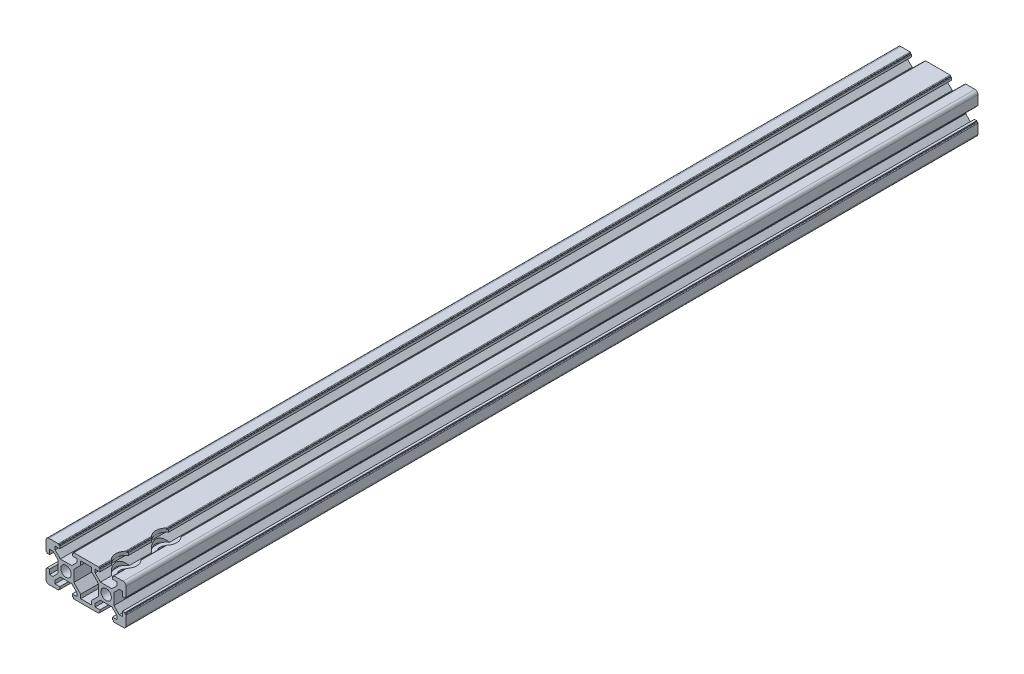
from build123d import *

# Parameters (mm, degrees)
SKETCH_1_R               = 2.6
EXTRUDE_1_DEPTH          = 212.5
FILLET_1_R               = 1.5
FILLET_2_R               = 0.3
CUT_EXTRUDE_1_DEPTH      = 214.891234042
CUT_EXTRUDE_1_DEPTH_BACK = 214.891234042
SKETCH_2_R               = 3.1
SKETCH_3_R               = 5.25
CUT_EXTRUDE_2_DEPTH      = 214.891234141


with BuildPart() as part:
    # 草图1 → 凸台-拉伸1 (new, symmetric)
    with BuildSketch(Plane.XY):
        Polygon((-13.9, 0), (-13.9, 2.839339828), (-16.560660172, 5.5), (-18.2, 5.5), (-18.2, 3.1), (-19.4, 3.1), (-19.4, 3.6), (-20, 3.6), (-20, 10), (-13.6, 10), (-13.6, 9.4), (-13.1, 9.4), (-13.1, 8.2), (-15.5, 8.2), (-15.5, 6.560660172), (-12.839339828, 3.9), (-7.160660172, 3.9), (-4.5, 6.560660172), (-4.5, 8.2), (-6.9, 8.2), (-6.9, 9.4), (-6.4, 9.4), (-6.4, 10), (6.4, 10), (6.4, 9.4), (6.9, 9.4), (6.9, 8.2), (4.5, 8.2), (4.5, 6.560660172), (7.160660172, 3.9), (12.839339828, 3.9), (15.5, 6.560660172), (15.5, 8.2), (13.1, 8.2), (13.1, 9.4), (13.6, 9.4), (13.6, 10), (20, 10), (20, 3.6), (19.4, 3.6), (19.4, 3.1), (18.2, 3.1), (18.2, 5.5), (16.560660172, 5.5), (13.9, 2.839339828), (13.9, 0), (13.9, -2.839339828), (16.560660172, -5.5), (18.2, -5.5), (18.2, -3.1), (19.4, -3.1), (19.4, -3.6), (20, -3.6), (20, -10), (13.6, -10), (13.6, -9.4), (13.1, -9.4), (13.1, -8.2), (15.5, -8.2), (15.5, -6.560660172), (12.839339828, -3.9), (7.160660172, -3.9), (4.5, -6.560660172), (4.5, -8.2), (6.9, -8.2), (6.9, -9.4), (6.4, -9.4), (6.4, -10), (-6.4, -10), (-6.4, -9.4), (-6.9, -9.4), (-6.9, -8.2), (-4.5, -8.2), (-4.5, -6.560660172), (-7.160660172, -3.9), (-12.839339828, -3.9), (-15.5, -6.560660172), (-15.5, -8.2), (-13.1, -8.2), (-13.1, -9.4), (-13.6, -9.4), (-13.6, -10), (-20, -10), (-20, -3.6), (-19.4, -3.6), (-19.4, -3.1), (-18.2, -3.1), (-18.2, -5.5), (-16.560660172, -5.5), (-13.9, -2.839339828), align=None)
        with Locations((-10, 0)):
            Circle(SKETCH_1_R, mode=Mode.SUBTRACT)
        with Locations(Location((10, 0, 0), (0, 0, 180))):
            Circle(SKETCH_1_R, mode=Mode.SUBTRACT)
        Polygon((-6.1, -2.839339828), (-6.1, 2.839339828), (-2.7, 6.239339828), (-2.7, 8.2), (2.7, 8.2), (2.7, 6.239339828), (6.1, 2.839339828), (6.1, -2.839339828), (2.7, -6.239339828), (2.7, -8.2), (-2.7, -8.2), (-2.7, -6.239339828), align=None, mode=Mode.SUBTRACT)
    extrude(amount=EXTRUDE_1_DEPTH, both=True)

    # 圆角1
    fillet_1_edges = [part.edges().sort_by_distance(p)[0] for p in [
        (-20, 10, 0),
        (20, 10, 0),
        (20, -10, 0),
        (-20, -10, 0),
    ]]
    fillet(fillet_1_edges, radius=FILLET_1_R)

    # 圆角2
    fillet_2_edges = [part.edges().sort_by_distance(p)[0] for p in [
        (-20, 3.6, 0),
        (-13.6, 10, 0),
        (-6.4, 10, 0),
        (6.4, 10, 0),
        (13.6, 10, 0),
        (20, 3.6, 0),
        (20, -3.6, 0),
        (13.6, -10, 0),
        (6.4, -10, 0),
        (-6.4, -10, 0),
        (-13.6, -10, 0),
        (-20, -3.6, 0),
    ]]
    fillet(fillet_2_edges, radius=FILLET_2_R)

    # 草图2 → 切除-拉伸1 (cut, two sides: drawn at the far end of the back side and taken through both)
    with BuildSketch(Plane(origin=(0, 3.9, 0), x_dir=(1, 0, 0), z_dir=(0, 1, 0)).offset(-CUT_EXTRUDE_1_DEPTH_BACK)):
        with Locations(Location((10, -202.5, 0), (0, 0, 203.663841572))):
            Circle(SKETCH_2_R)
        with Locations(Location((10, -182.5, 0), (0, 0, 203.663841572))):
            Circle(SKETCH_2_R)
    extrude(amount=CUT_EXTRUDE_1_DEPTH + CUT_EXTRUDE_1_DEPTH_BACK, mode=Mode.SUBTRACT)

    # 草图3 → 切除-拉伸2 (cut, through all)
    with BuildSketch(Plane(origin=(0, 3.9, 0), x_dir=(1, 0, 0), z_dir=(0, 1, 0))):
        with Locations((10, -182.5)):
            Circle(SKETCH_3_R)
        with Locations((10, -202.5)):
            Circle(SKETCH_3_R)
    extrude(amount=CUT_EXTRUDE_2_DEPTH, mode=Mode.SUBTRACT)


solid = part.part
